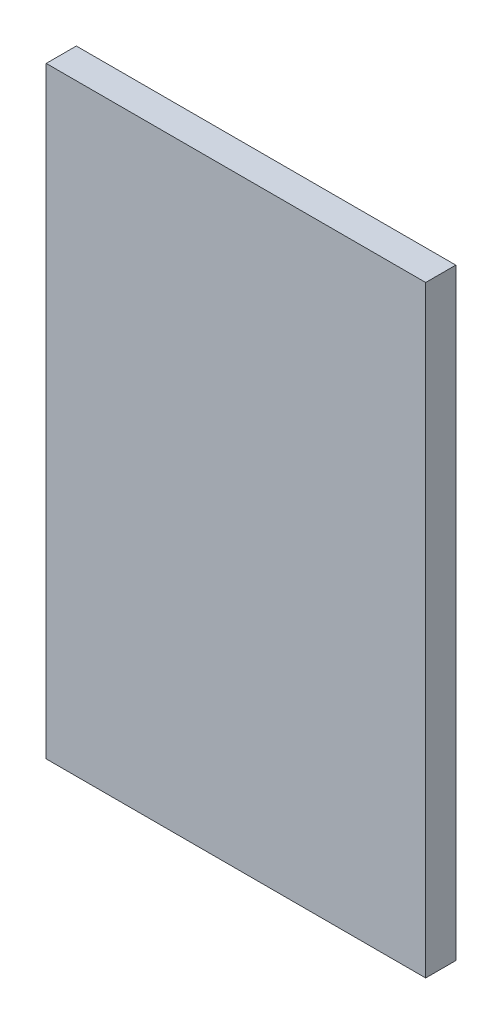
from build123d import *

# Parameters (mm, degrees)
SCHIZZO1_W                   = 252
SCHIZZO1_H                   = 400
ESTRUSIONE_ESTRUSIONE1_DEPTH = 20


with BuildPart() as part:
    # Schizzo1 → Estrusione-Estrusione1 (new body)
    with BuildSketch(Plane.XY):
        Rectangle(SCHIZZO1_W, SCHIZZO1_H)
    extrude(amount=ESTRUSIONE_ESTRUSIONE1_DEPTH)


solid = part.part
